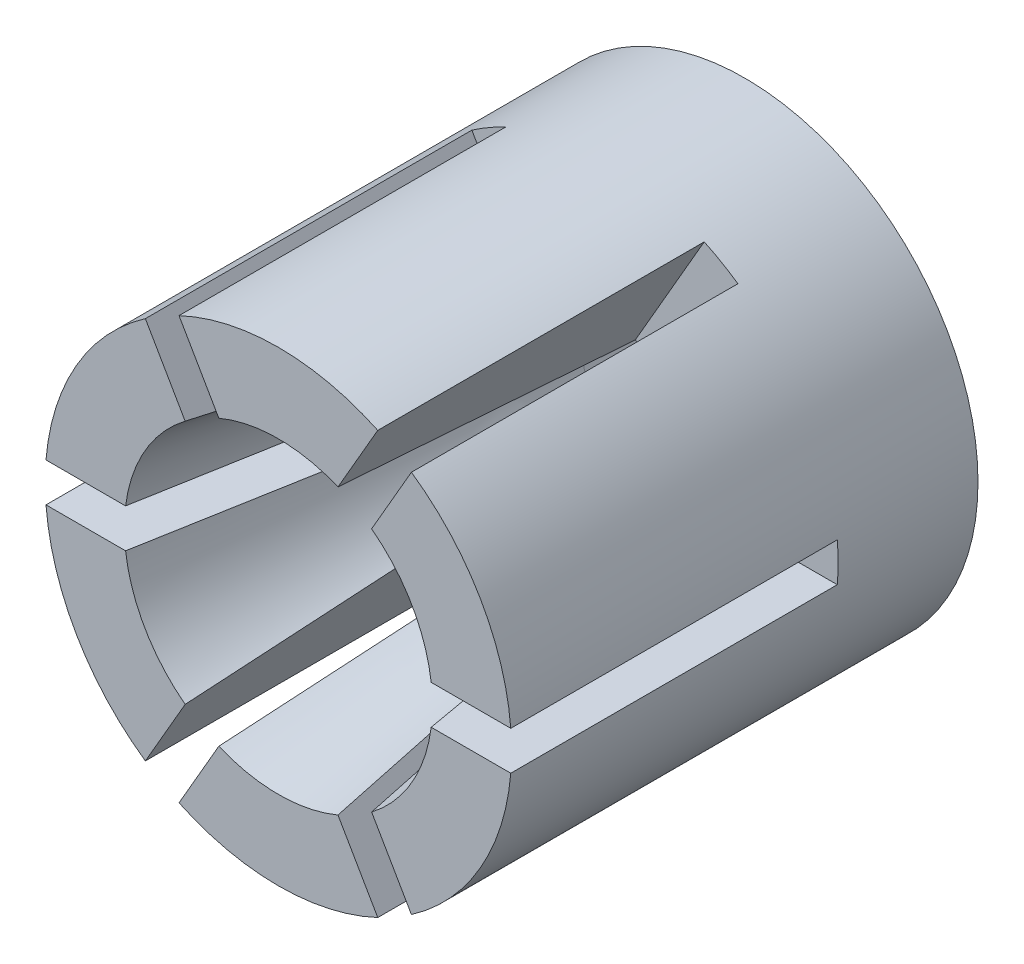
from build123d import *

# Parameters (mm, degrees)
SKETCH4_W          = 60
SKETCH4_H          = 30
CUT_EXTRUDE1_REACH = 75.485
SKETCH6_W          = 42
SKETCH6_H          = 5
CIRPATTERN3_COUNT  = 6


with BuildPart() as part:
    # Sketch4 → Revolve1 (revolve)
    with BuildSketch(Plane(origin=(0, 0, 0), x_dir=(0, 0, -1), z_dir=(1, 0, 0)), mode=Mode.PRIVATE) as revolve1_sk:
        with Locations((30, 15)):
            Rectangle(SKETCH4_W, SKETCH4_H)
    revolve(revolve1_sk.sketch.rotate(Axis((0, 0, 24.398391619), (0, 0, -1)), 90), axis=Axis((0, 0, 24.398391619), (0, 0, -1)))

    # Sketch5 → Cut-Revolve1 (revolve, cut)
    with BuildSketch(Plane(origin=(0, 0, 0), x_dir=(0, 0, -1), z_dir=(1, 0, 0)), mode=Mode.PRIVATE) as cut_revolve1_sk:
        Polygon((0, 0), (0, 19.816349035), (50, 11), (60, 11), (60, 0), align=None)
    revolve(cut_revolve1_sk.sketch.rotate(Axis((0, 0, 8.48865663), (0, 0, -1)), 90), axis=Axis((0, 0, 8.48865663), (0, 0, -1)), mode=Mode.SUBTRACT)

    # Sketch6 → Cut-Extrude1 (cut, up to next)
    with BuildSketch(Plane(origin=(0, 0, 0), x_dir=(0, 0, -1), z_dir=(1, 0, 0)), mode=Mode.PRIVATE) as cut_extrude1_sk1:
        with Locations((21, 0)):
            Rectangle(SKETCH6_W, SKETCH6_H)
    cut_extrude1_tool1 = extrude(cut_extrude1_sk1.sketch, amount=CUT_EXTRUDE1_REACH, mode=Mode.PRIVATE) & part.part
    cut_extrude1 = cut_extrude1_tool1.solids().sort_by_distance((0, 0, -21))[0]
    add(cut_extrude1, mode=Mode.SUBTRACT)

    # CirPattern3: Cut-Extrude1 ×6 about axis
    cirpattern3_axis = Axis((0, 0, 0), (0, 0, 1))
    for i in range(1, CIRPATTERN3_COUNT):
        add(cut_extrude1.rotate(cirpattern3_axis, i * 360 / CIRPATTERN3_COUNT), mode=Mode.SUBTRACT)


solid = part.part
